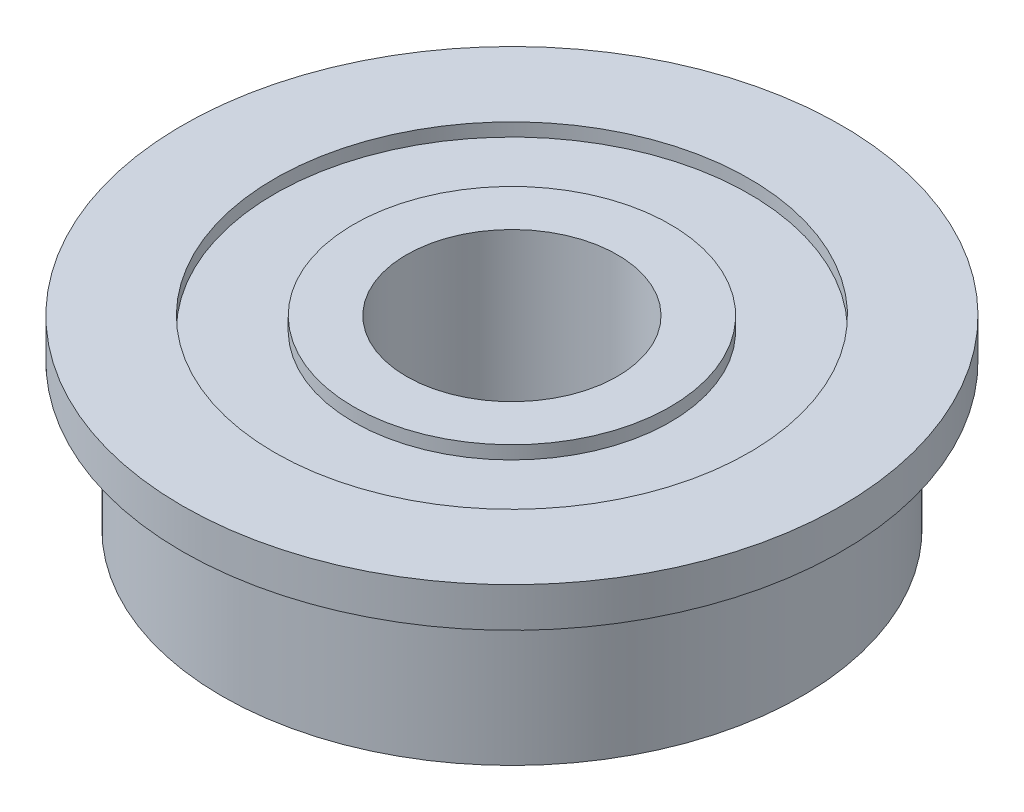
from build123d import *

# Parameters (mm, degrees)
SKETCH1_R           = 11
SKETCH1_R_2         = 4
BOSS_EXTRUDE1_DEPTH = 5.5
SKETCH2_R           = 12.5
SKETCH2_R_2         = 4
BOSS_EXTRUDE2_DEPTH = 1.5
SKETCH3_R           = 9
SKETCH3_R_2         = 6
CUT_EXTRUDE1_DEPTH  = 0.5
CUT_EXTRUDE2_START  = -0.5
SKETCH4_R           = 9
SKETCH4_R_2         = 6
CUT_EXTRUDE2_DEPTH  = 0.5


with BuildPart() as part:
    # Sketch1 → Boss-Extrude1 (new body)
    with BuildSketch(Plane(origin=(0, 0, 0), x_dir=(1, 0, 0), z_dir=(0, 1, 0))):
        with Locations(Location((0, 0, 0), (0, 0, 270))):
            Circle(SKETCH1_R)
        with Locations(Location((0, 0, 0), (0, 0, 270))):
            Circle(SKETCH1_R_2, mode=Mode.SUBTRACT)
    extrude(amount=BOSS_EXTRUDE1_DEPTH)

    # Sketch2 → Boss-Extrude2 (add)
    with BuildSketch(Plane(origin=(0, 5.5, 0), x_dir=(1, 0, 0), z_dir=(0, 1, 0))):
        with Locations(Location((0, 0, 0), (0, 0, 270))):
            Circle(SKETCH2_R)
        with Locations(Location((0, 0, 0), (0, 0, 270))):
            Circle(SKETCH2_R_2, mode=Mode.SUBTRACT)
    extrude(amount=BOSS_EXTRUDE2_DEPTH)

    # Sketch3 → Cut-Extrude1 (cut)
    with BuildSketch(Plane(origin=(0, 7, 0), x_dir=(1, 0, 0), z_dir=(0, 1, 0))):
        with Locations(Location((0, 0, 0), (0, 0, 270))):
            Circle(SKETCH3_R)
        with Locations(Location((0, 0, 0), (0, 0, 270))):
            Circle(SKETCH3_R_2, mode=Mode.SUBTRACT)
    extrude(amount=-CUT_EXTRUDE1_DEPTH, mode=Mode.SUBTRACT)

    # Sketch4 → Cut-Extrude2 (cut)
    with BuildSketch(Plane.XZ.offset(CUT_EXTRUDE2_START)):
        with Locations(Location((0, 0, 0), (0, 0, 90))):
            Circle(SKETCH4_R)
        with Locations(Location((0, 0, 0), (0, 0, 90))):
            Circle(SKETCH4_R_2, mode=Mode.SUBTRACT)
    extrude(amount=CUT_EXTRUDE2_DEPTH, mode=Mode.SUBTRACT)


solid = part.part
